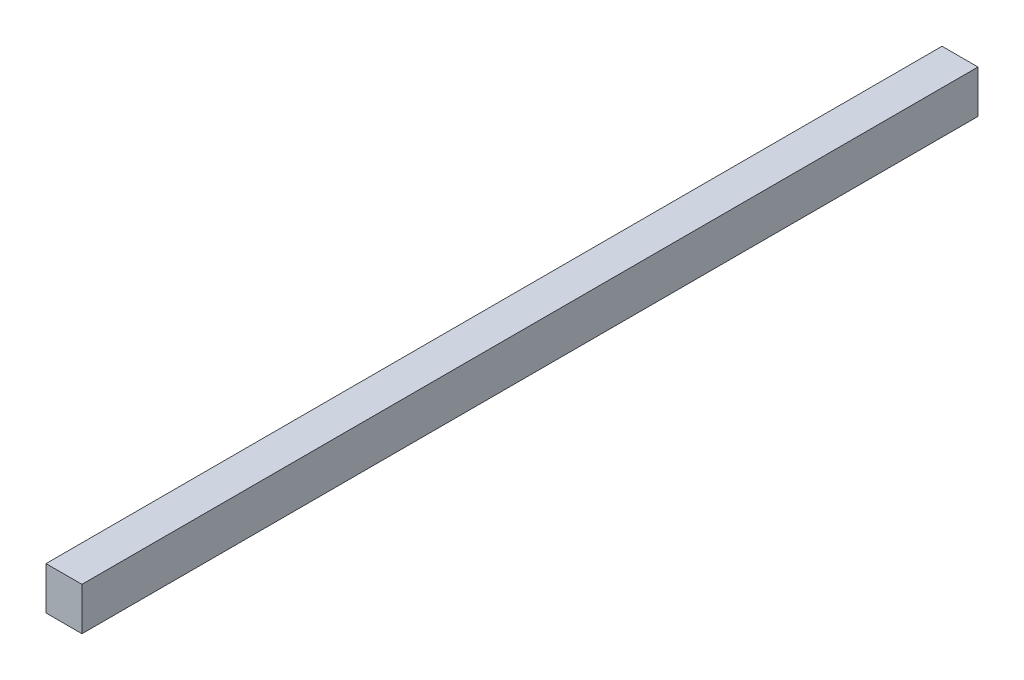
from build123d import *

# Parameters (mm, degrees)
ESQUISSE1_W        = 63
ESQUISSE1_H        = 75
BOSS_EXTRU_1_DEPTH = 1570


with BuildPart() as part:
    # Esquisse1 → Boss.-Extru.1 (new body)
    with BuildSketch(Plane.XY):
        with Locations((31.5, 37.5)):
            Rectangle(ESQUISSE1_W, ESQUISSE1_H)
    extrude(amount=BOSS_EXTRU_1_DEPTH)


solid = part.part
